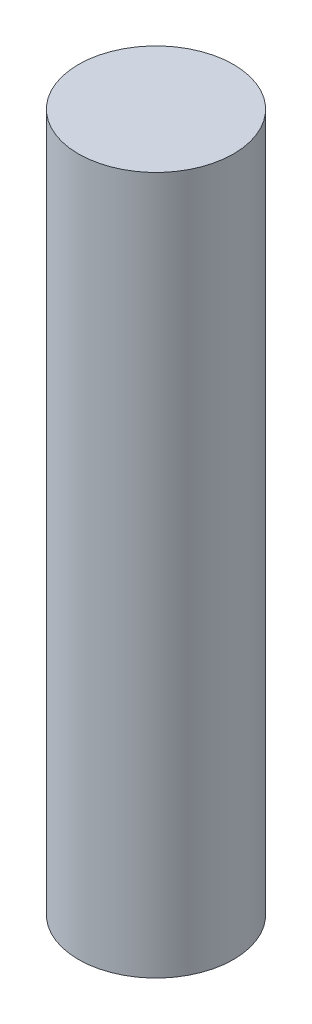
from build123d import *

# Parameters (mm, degrees)
SKETCH2_R           = 4
BOSS_EXTRUDE1_DEPTH = 36


with BuildPart() as part:
    # Sketch2 → Boss-Extrude1 (new body)
    with BuildSketch(Plane(origin=(0, 0, 0), x_dir=(1, 0, 0), z_dir=(0, 1, 0))):
        with Locations(Location((0, 0, 0), (0, 0, 270))):
            Circle(SKETCH2_R)
    extrude(amount=BOSS_EXTRUDE1_DEPTH)


solid = part.part
